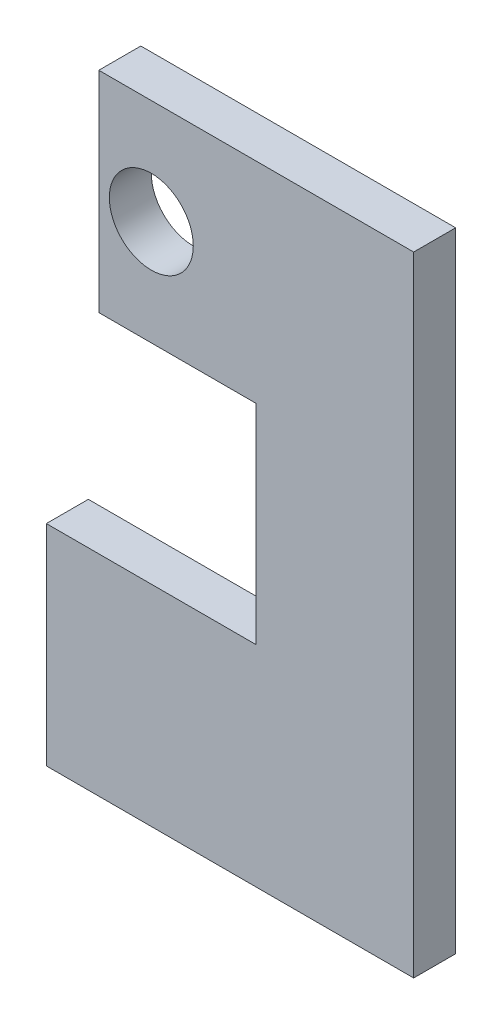
from build123d import *

# Parameters (mm, degrees)
SKETCH1_R           = 20
BOSS_EXTRUDE2_DEPTH = 20


with BuildPart() as part:
    # Sketch1 → Boss-Extrude2 (new body)
    with BuildSketch(Plane.XY):
        Polygon((0, -50), (0, -149.536956037), (-100, -149.536956037), (-100, -249.536956037), (75, -249.536956037), (75, -50), (75, 50), (-75, 50), (-75, -50), align=None)
        with Locations((-50, 0)):
            Circle(SKETCH1_R, mode=Mode.SUBTRACT)
    extrude(amount=BOSS_EXTRUDE2_DEPTH)


solid = part.part
